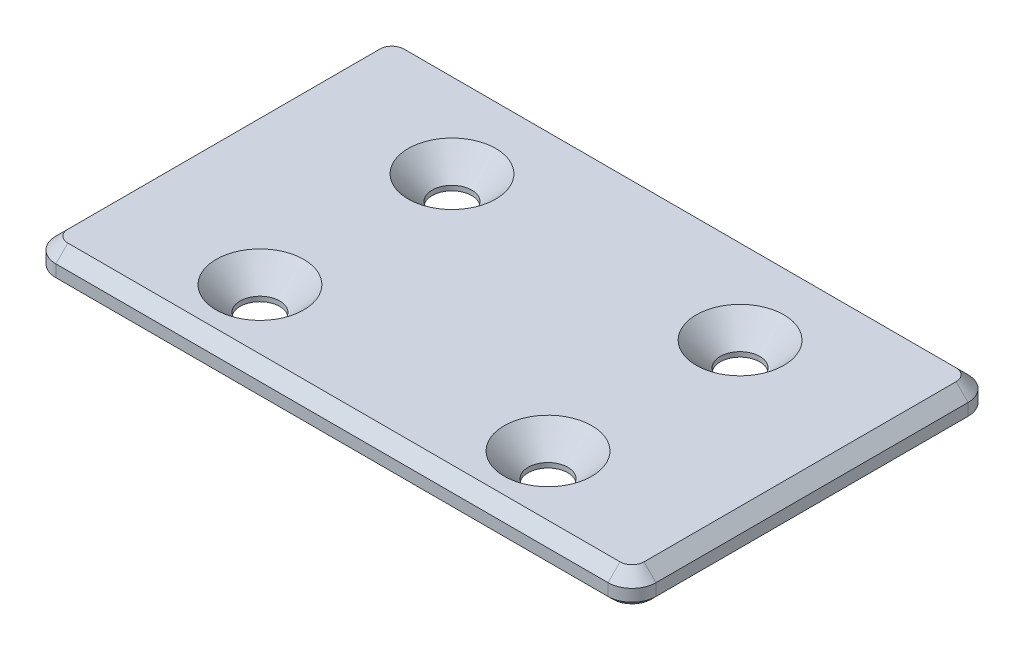
from build123d import *

# Parameters (mm, degrees)
SKETCH_1_W          = 50
SKETCH_1_H          = 30
EXTRUDE_1_DEPTH     = 2.4
SKETCH_2_R          = 1.65
CUT_EXTRUDE_1_DEPTH = 59.35888964
CHAMFER_1_SIZE      = 2
FILLET_1_R          = 2
CHAMFER_2_SIZE      = 1
CHAMFER_3_SIZE      = 0.4


with BuildPart() as part:
    # 草图1 → 凸台-拉伸1 (new body)
    with BuildSketch(Plane(origin=(0, 0, 0), x_dir=(1, 0, 0), z_dir=(0, 1, 0))):
        with Locations((25, 15)):
            Rectangle(SKETCH_1_W, SKETCH_1_H)
    extrude(amount=EXTRUDE_1_DEPTH)

    # 草图2 → 切除-拉伸1 (cut, through all)
    with BuildSketch(Plane(origin=(0, 2.4, 0), x_dir=(1, 0, 0), z_dir=(0, 1, 0))):
        with Locations(Location((13, 6, 0), (0, 0, 270))):
            Circle(SKETCH_2_R)
        with Locations(Location((37, 6, 0), (0, 0, 270))):
            Circle(SKETCH_2_R)
        with Locations(Location((13, 22, 0), (0, 0, 270))):
            Circle(SKETCH_2_R)
        with Locations(Location((37, 22, 0), (0, 0, 270))):
            Circle(SKETCH_2_R)
    extrude(amount=-CUT_EXTRUDE_1_DEPTH, mode=Mode.SUBTRACT)

    # 倒角1
    chamfer_1_edges = [part.edges().sort_by_distance(p)[0] for p in [
        (13, 2.4, -7.65),
        (37, 2.4, -23.65),
        (37, 2.4, -7.65),
        (13, 2.4, -23.65),
    ]]
    chamfer(chamfer_1_edges, length=CHAMFER_1_SIZE)

    # 圆角1
    fillet_1_edges = [part.edges().sort_by_distance(p)[0] for p in [
        (0, 1.2, -30),
        (50, 1.2, -30),
        (50, 1.2, 0),
        (0, 1.2, 0),
    ]]
    fillet(fillet_1_edges, radius=FILLET_1_R)

    # 倒角2
    chamfer_2_edges = [part.edges().sort_by_distance(p)[0] for p in [
        (25, 2.4, -30),
        (50, 2.4, -15),
        (0, 2.4, -15),
        (25, 2.4, 0),
        (0.585786438, 2.4, -29.414213562),
        (0.585786438, 2.4, -0.585786438),
        (49.414213562, 2.4, -0.585786438),
        (49.414213562, 2.4, -29.414213562),
    ]]
    chamfer(chamfer_2_edges, length=CHAMFER_2_SIZE)

    # 倒角3
    chamfer_3_edges = [part.edges().sort_by_distance(p)[0] for p in [
        (25, 0, -30),
        (0, 0, -15),
        (50, 0, -15),
        (25, 0, 0),
        (0.585786438, 0, -29.414213562),
        (0.585786438, 0, -0.585786438),
        (49.414213562, 0, -0.585786438),
        (49.414213562, 0, -29.414213562),
    ]]
    chamfer(chamfer_3_edges, length=CHAMFER_3_SIZE)


solid = part.part
